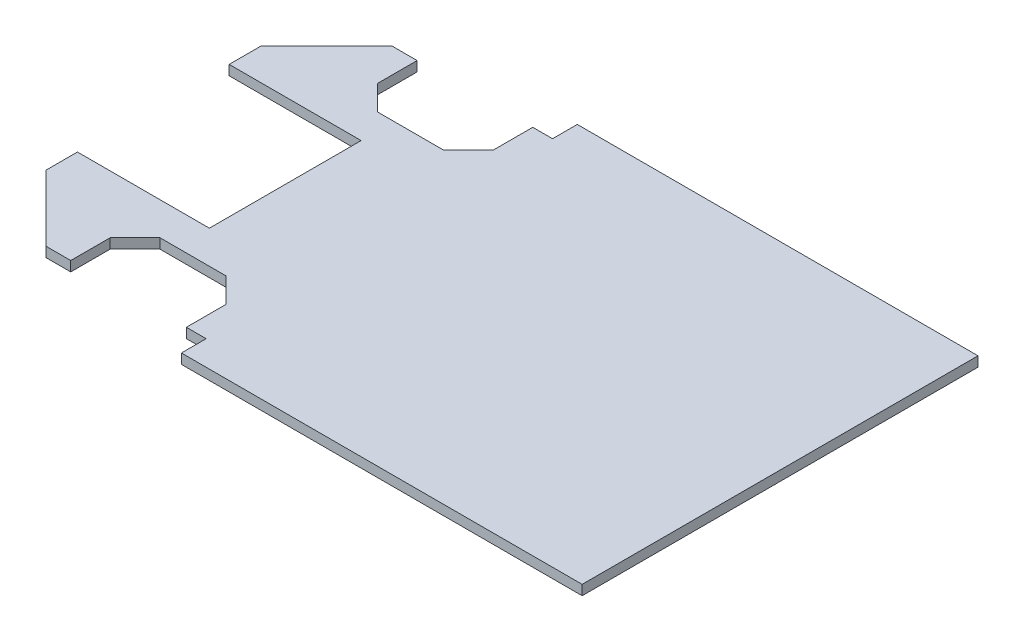
from build123d import *

# Parameters (mm, degrees)
BOSS_EXTRUDE1_DEPTH = 3


with BuildPart() as part:
    # Sketch1 → Boss-Extrude1 (new body)
    with BuildSketch(Plane(origin=(0, 0, 0), x_dir=(1, 0, 0), z_dir=(0, 1, 0))):
        Polygon((68.526631134, -52.5), (68.526631134, -60), (190, -60), (190, 60), (68.526631134, 60), (68.526631134, 52.5), (62.526631134, 52.5), (62.526631134, 40.526631134), (55, 33), (35, 33), (27.473368866, 40.526631134), (27.473368866, 52.5), (19.973368866, 52.5), (0, 32.526631134), (0, 23), (40, 23), (40, -23), (0, -23), (0, -32.526631134), (19.973368866, -52.5), (27.473368866, -52.5), (27.473368866, -40.526631134), (35, -33), (55, -33), (62.526631134, -40.526631134), (62.526631134, -52.5), align=None)
    extrude(amount=BOSS_EXTRUDE1_DEPTH)


solid = part.part
